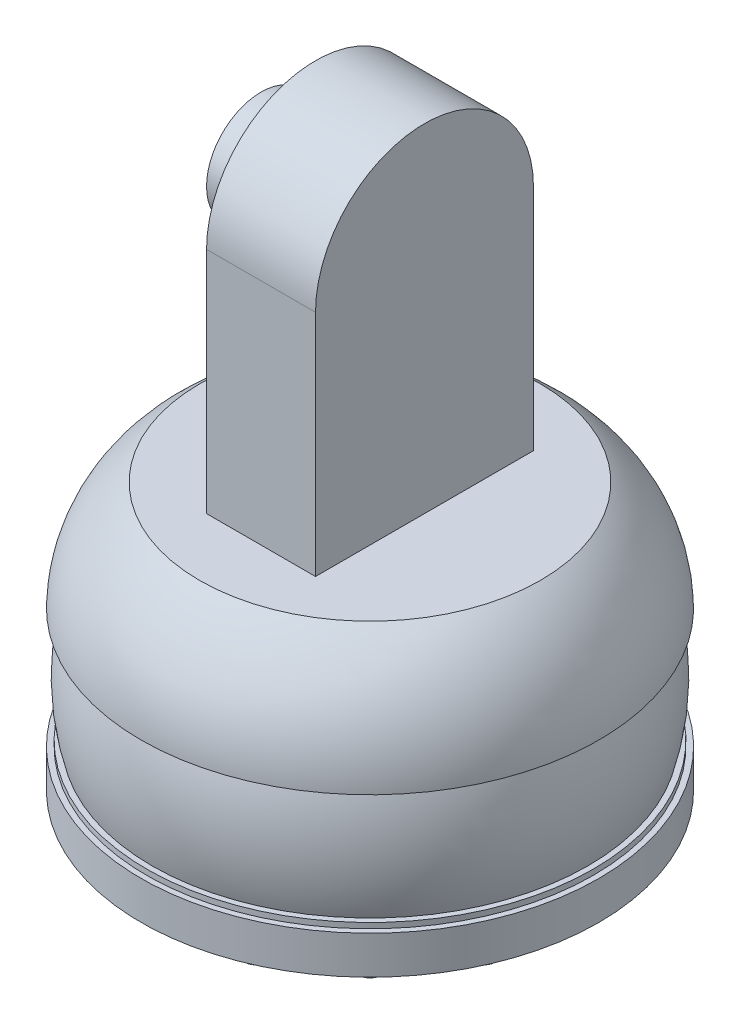
from build123d import *

# Parameters (mm, degrees)
SKETCH2_R           = 39.5
BOSS_EXTRUDE1_DEPTH = 1
SKETCH4_R           = 41
BOSS_EXTRUDE2_DEPTH = 1
SKETCH5_R           = 42
BOSS_EXTRUDE3_DEPTH = 7
SKETCH6_R           = 35
BOSS_EXTRUDE4_DEPTH = 3
BOSS_EXTRUDE5_DEPTH = 1
CIRPATTERN1_COUNT   = 16
SKETCH8_W           = 20
SKETCH8_H           = 40
BOSS_EXTRUDE6_DEPTH = 42
SKETCH9_R           = 20
BOSS_EXTRUDE7_DEPTH = 20
SKETCH10_R          = 10
BOSS_EXTRUDE8_DEPTH = 10
SKETCH11_R          = 10
BOSS_EXTRUDE9_DEPTH = 10


with BuildPart() as part:
    # Sketch1 → Revolve1 (revolve)
    with BuildSketch(Plane(origin=(0, 0, 0), x_dir=(0, 0, -1), z_dir=(1, 0, 0)), mode=Mode.PRIVATE) as revolve1_sk:
        with BuildLine():
            Line((0, 0), (-42, 0))
            ThreePointArc((-42, 0), (-39.032396198, 11.288859787), (-31.263157895, 20))
            Line((-31.263157895, 20), (0, 20))
            Line((0, 20), (0, 0))
        make_face()
    revolve(revolve1_sk.sketch.rotate(Axis((0, 0, 0), (0, 1, 0)), 180), axis=Axis((0, 0, 0), (0, 1, 0)))

    # Sketch2 → Boss-Extrude1 (add)
    with BuildSketch(Plane.XZ):
        with Locations(Location((0, 0, 0), (0, 0, 270))):
            Circle(SKETCH2_R)
    extrude(amount=BOSS_EXTRUDE1_DEPTH)

    # Sketch3 → Revolve2 (revolve)
    with BuildSketch(Plane.XY, mode=Mode.PRIVATE) as revolve2_sk:
        with BuildLine():
            Line((0, -1), (0, -21))
            Line((0, -21), (-40, -21))
            ThreePointArc((-40, -21), (-41.376973739, -11), (-40, -1))
            Line((-40, -1), (0, -1))
        make_face()
    revolve(revolve2_sk.sketch.rotate(Axis((0, -1, 0), (0, -1, 0)), 90), axis=Axis((0, -1, 0), (0, -1, 0)))

    # Sketch4 → Boss-Extrude2 (add)
    with BuildSketch(Plane.XZ.offset(21)):
        Circle(SKETCH4_R)
    extrude(amount=BOSS_EXTRUDE2_DEPTH)

    # Sketch5 → Boss-Extrude3 (add)
    with BuildSketch(Plane.XZ.offset(22)):
        Circle(SKETCH5_R)
    extrude(amount=BOSS_EXTRUDE3_DEPTH)

    # Sketch6 → Boss-Extrude4 (add)
    with BuildSketch(Plane.XZ.offset(29)):
        Circle(SKETCH6_R)
    extrude(amount=BOSS_EXTRUDE4_DEPTH)

    # Sketch7 → Boss-Extrude5 (add)
    with BuildSketch(Plane.XZ.offset(29)):
        with BuildLine():
            ThreePointArc((37, 0), (38.5, 1.5), (40, 0))
            Line((40, 0), (40.75, 0))
            ThreePointArc((40.75, 0), (38.5, 2.25), (36.25, 0))
            Line((36.25, 0), (37, 0))
        make_face()
        with BuildLine():
            Line((40.75, 0), (40, 0))
            ThreePointArc((40, 0), (38.5, -1.5), (37, 0))
            Line((37, 0), (36.25, 0))
            ThreePointArc((36.25, 0), (38.5, -2.25), (40.75, 0))
        make_face()
    boss_extrude5 = extrude(amount=BOSS_EXTRUDE5_DEPTH)

    # CirPattern1: Boss-Extrude5 ×16 about axis
    cirpattern1_axis = Axis((0, 0, 0), (0, 1, 0))
    for i in range(1, CIRPATTERN1_COUNT):
        add(boss_extrude5.rotate(cirpattern1_axis, i * 360 / CIRPATTERN1_COUNT))

    # Sketch8 → Boss-Extrude6 (add)
    with BuildSketch(Plane(origin=(0, 20, 0), x_dir=(1, 0, 0), z_dir=(0, 1, 0))):
        Rectangle(SKETCH8_W, SKETCH8_H)
    extrude(amount=BOSS_EXTRUDE6_DEPTH)

    # Sketch9 → Boss-Extrude7 (add)
    with BuildSketch(Plane(origin=(10, 0, 0), x_dir=(0, 0, -1), z_dir=(1, 0, 0))):
        with Locations((0, 62)):
            Circle(SKETCH9_R)
    extrude(amount=-BOSS_EXTRUDE7_DEPTH)

    # Sketch10 → Boss-Extrude8 (add)
    with BuildSketch(Plane.ZY.offset(10)):
        with Locations(Location((0, 62, 0), (0, 0, 180))):
            Circle(SKETCH10_R)
    extrude(amount=BOSS_EXTRUDE8_DEPTH)

    # Sketch11 → Boss-Extrude9 (add)
    with BuildSketch(Plane.XZ.offset(32)):
        Circle(SKETCH11_R)
    extrude(amount=BOSS_EXTRUDE9_DEPTH)


solid = part.part
